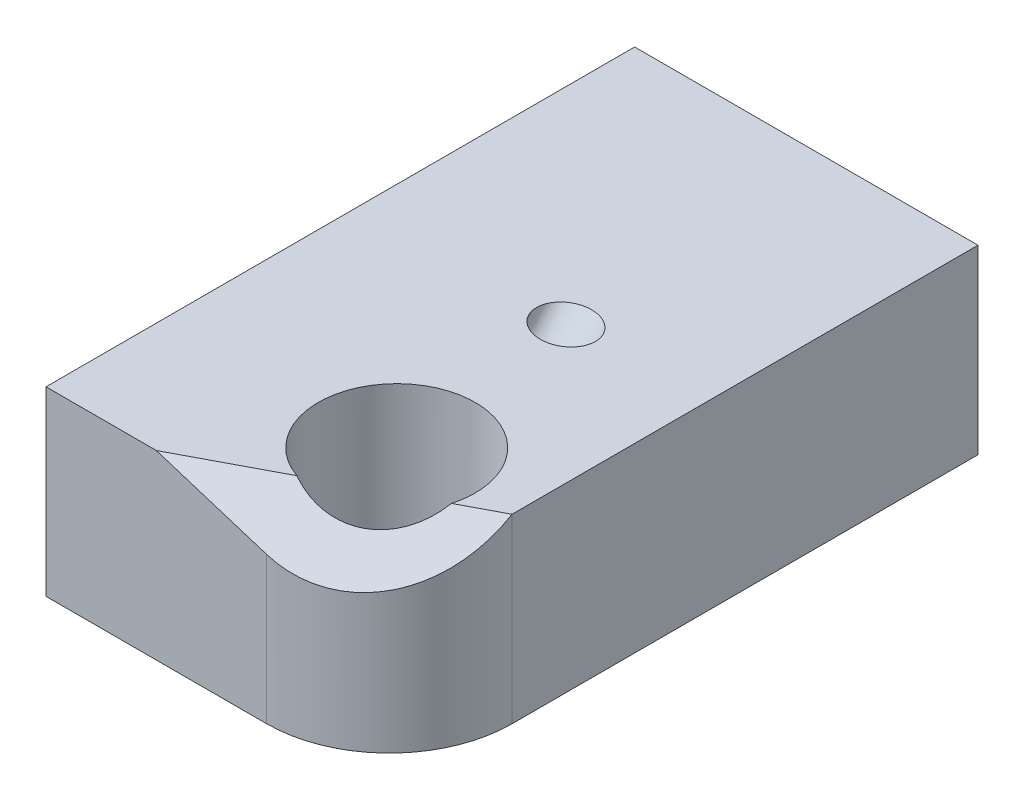
from build123d import *

# Parameters (mm, degrees)
SKETCH1_W               = 88.9
SKETCH1_H               = 152.4
BOSS_EXTRUDE1_DEPTH     = 46.99
FILLET1_R               = 31.75
CUT_EXTRUDE1_DEPTH      = 143.235650654
SKETCH6_R               = 20.32
CUT_EXTRUDE2_DEPTH      = 40.64
CUT_EXTRUDE3_REACH      = 154.734
CUT_EXTRUDE3_END_RADIUS = 20.32
SKETCH14_RX             = 7.62
SKETCH14_RY             = 5.08


with BuildPart() as part:
    # Sketch1 → Boss-Extrude1 (new body)
    with BuildSketch(Plane(origin=(0, 0, 0), x_dir=(1, 0, 0), z_dir=(0, 1, 0))):
        Rectangle(SKETCH1_W, SKETCH1_H)
    extrude(amount=BOSS_EXTRUDE1_DEPTH)

    # Fillet1
    fillet1_edges = [part.edges().sort_by_distance(p)[0] for p in [
        (44.45, 23.495, 76.2),
    ]]
    fillet(fillet1_edges, radius=FILLET1_R)

    # Sketch11 → Cut-Extrude1 (cut, through all)
    with BuildSketch(Plane(origin=(18.971914377, 60.07772886, 36.046637316), x_dir=(0.9652375973044347, -0.2241263770830731, -0.13447582624984392), z_dir=(0.2613740246274715, 0.8276844113203264, 0.49661064679219535))):
        Polygon((-36.101903277, -41.164805392), (26.395662264, -50.965949533), (26.395662264, -13.939405), align=None)
    extrude(amount=CUT_EXTRUDE1_DEPTH, mode=Mode.SUBTRACT)

    # Sketch6 → Cut-Extrude2 (cut)
    with BuildSketch(Plane(origin=(0, 46.99, 0), x_dir=(1, 0, 0), z_dir=(0, 1, 0))):
        with Locations(Location((14.605, -44.45, 0), (0, 0, 270))):
            Circle(SKETCH6_R)
    extrude(amount=-CUT_EXTRUDE2_DEPTH, mode=Mode.SUBTRACT)

    # Cut-Extrude3: up to this cylinder (the profile starts outside it)
    cut_extrude3_end = Plane(origin=(14.605, 82.009764, 44.45), z_dir=(0, 1, 0)) * Cylinder(CUT_EXTRUDE3_END_RADIUS, 351.108, mode=Mode.PRIVATE)
    # Sketch14 → Cut-Extrude3 (cut, up to the surface)
    with BuildSketch(Plane(origin=(0, 65.096039324, -54.622062588), x_dir=(-1, 0, 0), z_dir=(0, 0.7660444431189772, -0.6427876096865403)), mode=Mode.PRIVATE) as cut_extrude3_sk1:
        with Locations(Location((-8.89, 26.313084008), (0, 0, 180))):
            Ellipse(SKETCH14_RX, SKETCH14_RY)
    cut_extrude3_tool1 = extrude(cut_extrude3_sk1.sketch, amount=-CUT_EXTRUDE3_REACH, mode=Mode.PRIVATE) - cut_extrude3_end
    add(cut_extrude3_tool1.solids().sort_by_distance((8.89, 82.009764, -34.465071))[0], mode=Mode.SUBTRACT)


solid = part.part
